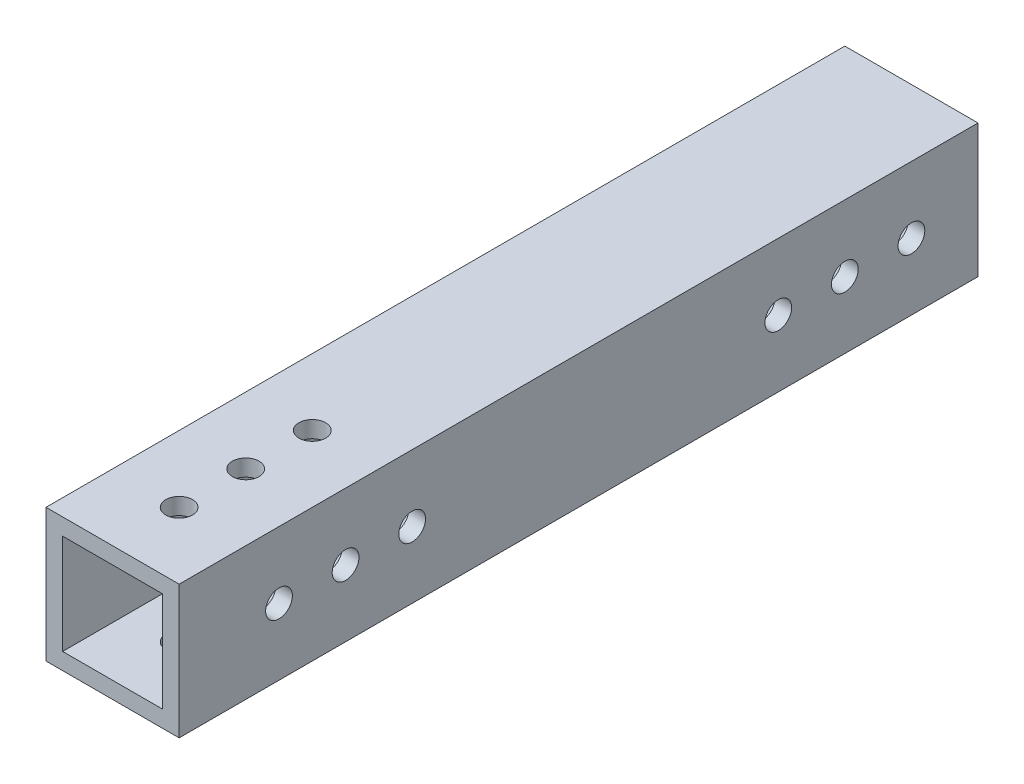
from build123d import *

# Parameters (mm, degrees)
SKETCH3_W              = 25.4
SKETCH3_H              = 25.4
SKETCH3_W_2            = 19.05
SKETCH3_H_2            = 19.05
BOSS_EXTRUDE1_DEPTH    = 152.4
F_10_CLEARANCE_HOLE1_D = 5.1054
F_10_CLEARANCE_HOLE2_D = 5.1054
F_10_CLEARANCE_HOLE3_D = 5.1054


with BuildPart() as part:
    # Sketch3 → Boss-Extrude1 (new body)
    with BuildSketch(Plane.XY):
        with Locations((-12.7, 12.7)):
            Rectangle(SKETCH3_W, SKETCH3_H)
        with Locations((-12.7, 12.7)):
            Rectangle(SKETCH3_W_2, SKETCH3_H_2, mode=Mode.SUBTRACT)
    extrude(amount=BOSS_EXTRUDE1_DEPTH)

    # #10 Clearance Hole1 (through all)
    with Locations(Plane(origin=(0, 25.4, 0), x_dir=(1, 0, 0), z_dir=(0, 1, 0))):
        with Locations((-12.7, -139.7), (-12.7, -127), (-12.7, -114.3)):
            Hole(F_10_CLEARANCE_HOLE1_D / 2)

    # #10 Clearance Hole2 (through all)
    with Locations(Plane.ZY.offset(25.4)):
        with Locations((133.35, 12.7), (120.65, 12.7), (107.95, 12.7)):
            Hole(F_10_CLEARANCE_HOLE2_D / 2)

    # #10 Clearance Hole3 (through all)
    with Locations(Plane(origin=(0, 0, 0), x_dir=(0, 0, -1), z_dir=(1, 0, 0))):
        with Locations((-12.7, 12.7), (-25.4, 12.7), (-38.1, 12.7)):
            Hole(F_10_CLEARANCE_HOLE3_D / 2)


solid = part.part
